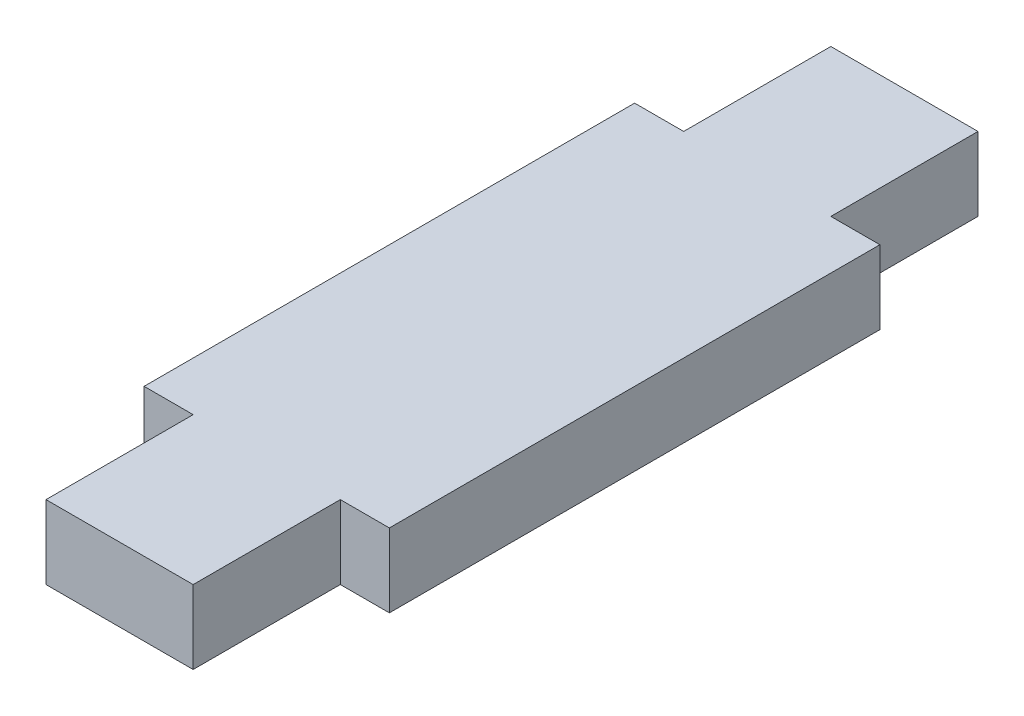
from build123d import *

# Parameters (mm, degrees)
BOSS_EXTRUDE1_DEPTH = 3


with BuildPart() as part:
    # Sketch1 → Boss-Extrude1 (new body)
    with BuildSketch(Plane(origin=(0, 0, 0), x_dir=(1, 0, 0), z_dir=(0, 1, 0))):
        Polygon((-5, 10), (-3, 10), (-3, 16), (3, 16), (3, 10), (5, 10), (5, -10), (3, -10), (3, -16), (-3, -16), (-3, -10), (-5, -10), align=None)
    extrude(amount=BOSS_EXTRUDE1_DEPTH)


solid = part.part
